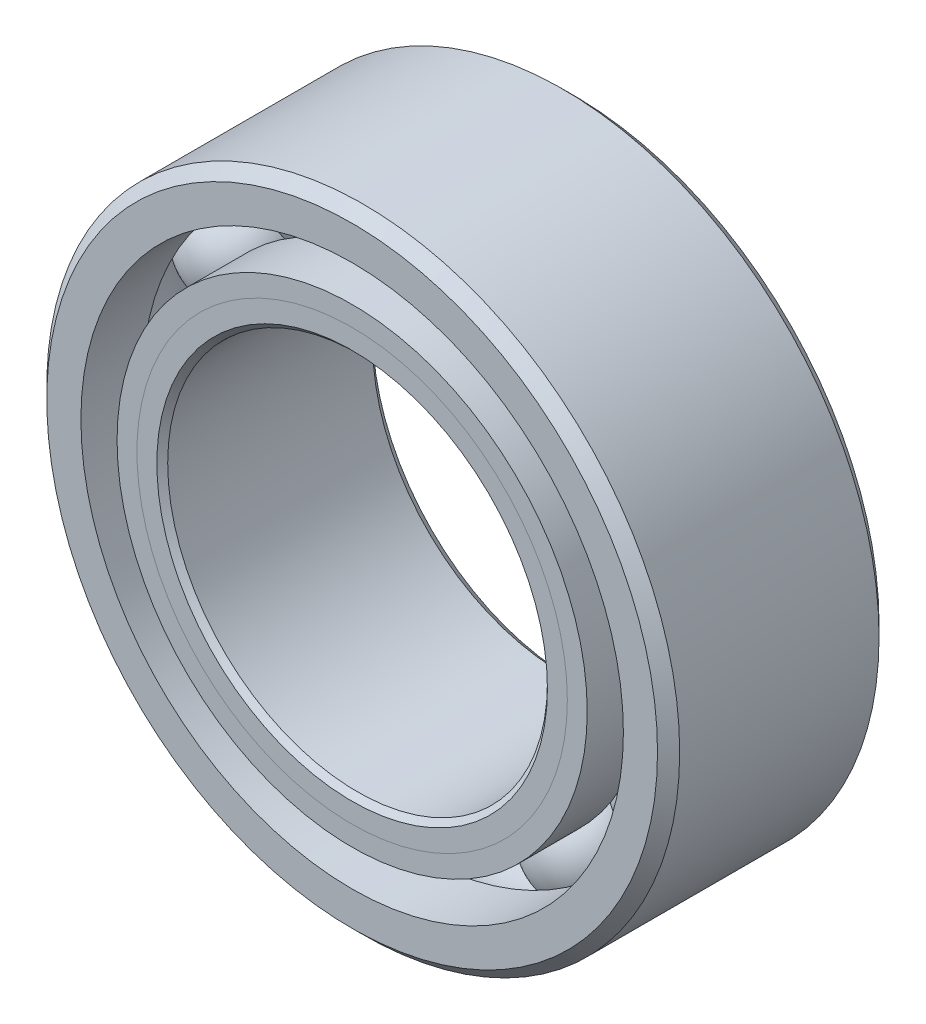
from build123d import *

# Parameters (mm, degrees)
CIRPATTERN1_COUNT = 12


with BuildPart() as part:
    # Sketch1 → Revolve1 (revolve)
    with BuildSketch(Plane(origin=(0, 0, 0), x_dir=(0, 0, -1), z_dir=(1, 0, 0)), mode=Mode.PRIVATE) as revolve1_sk:
        with BuildLine():
            Line((1.25015625, 3.96875), (-1.25015625, 3.96875))
            Line((-1.25015625, 3.96875), (-1.3890625, 3.82984375))
            Line((-1.3890625, 3.82984375), (-1.3890625, 3.401785714))
            Line((-1.3890625, 3.401785714), (-0.617361111, 3.401785714))
            ThreePointArc((-0.617361111, 3.401785714), (0, 3.83269788), (0.617361111, 3.401785714))
            Line((0.617361111, 3.401785714), (1.3890625, 3.401785714))
            Line((1.3890625, 3.401785714), (1.3890625, 3.82984375))
            Line((1.3890625, 3.82984375), (1.25015625, 3.96875))
        make_face()
    revolve(revolve1_sk.sketch.rotate(Axis((0, 0, 1.3890625), (0, 0, -1)), 90), axis=Axis((0, 0, 1.3890625), (0, 0, -1)))


with BuildPart() as body_2:
    # Sketch2 → Revolve2 (revolve)
    with BuildSketch(Plane(origin=(0, 0, 0), x_dir=(0, 0, -1), z_dir=(1, 0, 0)), mode=Mode.PRIVATE) as revolve2_sk:
        with BuildLine():
            Line((-1.3890625, 2.948214286), (-0.617361111, 2.948214286))
            ThreePointArc((-0.617361111, 2.948214286), (-0.376437258, 2.635684237), (0, 2.51730212))
            Line((0, 2.51730212), (0, 2.44927606))
            Line((0, 2.44927606), (-1.139593387, 2.44927606))
            Line((-1.139593387, 2.44927606), (-1.3890625, 2.698745173))
            Line((-1.3890625, 2.698745173), (-1.3890625, 2.948214286))
        make_face()
    revolve(revolve2_sk.sketch.rotate(Axis((0, 0, 1.3890625), (0, 0, -1)), 90), axis=Axis((0, 0, 1.3890625), (0, 0, -1)))


with BuildPart() as body_3:
    # Sketch3 → Revolve3 (revolve)
    with BuildSketch(Plane(origin=(0, 0, 0), x_dir=(0, 0, -1), z_dir=(1, 0, 0)), mode=Mode.PRIVATE) as revolve3_sk:
        with BuildLine():
            Line((-1.3890625, 2.698745173), (-1.139593387, 2.44927606))
            Line((-1.139593387, 2.44927606), (0, 2.44927606))
            Line((0, 2.44927606), (0, 2.51730212))
            ThreePointArc((0, 2.51730212), (0.376437258, 2.635684237), (0.617361111, 2.948214286))
            Line((0.617361111, 2.948214286), (1.3890625, 2.948214286))
            Line((1.3890625, 2.948214286), (1.3890625, 2.52015625))
            Line((1.3890625, 2.52015625), (1.25015625, 2.38125))
            Line((1.25015625, 2.38125), (-1.32103644, 2.38125))
            Line((-1.32103644, 2.38125), (-1.3890625, 2.44927606))
            Line((-1.3890625, 2.44927606), (-1.3890625, 2.698745173))
        make_face()
    revolve(revolve3_sk.sketch.rotate(Axis((0, 0, 1.3890625), (0, 0, -1)), 90), axis=Axis((0, 0, 1.3890625), (0, 0, -1)))


with BuildPart() as body_4:
    # Sketch4 → Revolve4 (revolve)
    with BuildSketch(Plane(origin=(0, 0, 0), x_dir=(0, 0, -1), z_dir=(1, 0, 0))):
        with BuildLine():
            Line((-0.65769788, 3.175), (0.65769788, 3.175))
            ThreePointArc((0.65769788, 3.175), (0, 3.83269788), (-0.65769788, 3.175))
        make_face()
    revolve(axis=Axis((0, 3.175, 0.65769788), (0, 0, -1)))


with BuildPart() as cirpattern1_1:
    # CirPattern1: pattern copy
    add(body_4.part.rotate(Axis((0, 0, 0), (0, 0, 1)), 1 * 360 / CIRPATTERN1_COUNT))


with BuildPart() as cirpattern1_2:
    # CirPattern1: pattern copy
    add(body_4.part.rotate(Axis((0, 0, 0), (0, 0, 1)), 2 * 360 / CIRPATTERN1_COUNT))


with BuildPart() as cirpattern1_3:
    # CirPattern1: pattern copy
    add(body_4.part.rotate(Axis((0, 0, 0), (0, 0, 1)), 3 * 360 / CIRPATTERN1_COUNT))


with BuildPart() as cirpattern1_4:
    # CirPattern1: pattern copy
    add(body_4.part.rotate(Axis((0, 0, 0), (0, 0, 1)), 4 * 360 / CIRPATTERN1_COUNT))


with BuildPart() as cirpattern1_5:
    # CirPattern1: pattern copy
    add(body_4.part.rotate(Axis((0, 0, 0), (0, 0, 1)), 5 * 360 / CIRPATTERN1_COUNT))


with BuildPart() as cirpattern1_6:
    # CirPattern1: pattern copy
    add(body_4.part.rotate(Axis((0, 0, 0), (0, 0, 1)), 6 * 360 / CIRPATTERN1_COUNT))


with BuildPart() as cirpattern1_7:
    # CirPattern1: pattern copy
    add(body_4.part.rotate(Axis((0, 0, 0), (0, 0, 1)), 7 * 360 / CIRPATTERN1_COUNT))


with BuildPart() as cirpattern1_8:
    # CirPattern1: pattern copy
    add(body_4.part.rotate(Axis((0, 0, 0), (0, 0, 1)), 8 * 360 / CIRPATTERN1_COUNT))


with BuildPart() as cirpattern1_9:
    # CirPattern1: pattern copy
    add(body_4.part.rotate(Axis((0, 0, 0), (0, 0, 1)), 9 * 360 / CIRPATTERN1_COUNT))


with BuildPart() as cirpattern1_10:
    # CirPattern1: pattern copy
    add(body_4.part.rotate(Axis((0, 0, 0), (0, 0, 1)), 10 * 360 / CIRPATTERN1_COUNT))


with BuildPart() as cirpattern1_11:
    # CirPattern1: pattern copy
    add(body_4.part.rotate(Axis((0, 0, 0), (0, 0, 1)), 11 * 360 / CIRPATTERN1_COUNT))


solid = Compound([part.part, body_2.part, body_3.part, body_4.part, cirpattern1_1.part, cirpattern1_2.part, cirpattern1_3.part, cirpattern1_4.part, cirpattern1_5.part, cirpattern1_6.part, cirpattern1_7.part, cirpattern1_8.part, cirpattern1_9.part, cirpattern1_10.part, cirpattern1_11.part])
